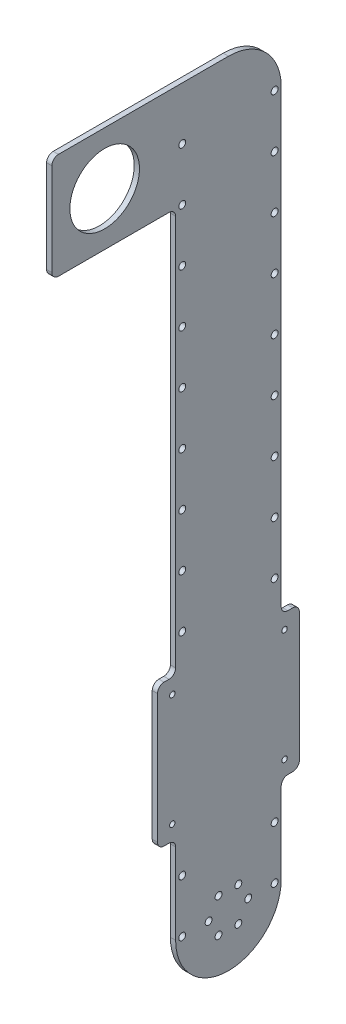
from build123d import *

# Parameters (mm, degrees)
BOSS_EXTRUDE1_DEPTH = 1.5875
SKETCH2_R           = 2.1
CUT_EXTRUDE1_DEPTH  = 243.144751389
SKETCH3_W           = 86
SKETCH3_H           = 86
SKETCH3_R           = 1.65
BOSS_EXTRUDE2_DEPTH = 3.175
FILLET1_R           = 4
SKETCH5_R           = 2.1
CUT_EXTRUDE3_DEPTH  = 244.842327386
SKETCH6_R           = 21.1
BOSS_EXTRUDE3_DEPTH = 3.175
FILLET2_R           = 4


with BuildPart() as part:
    # Sketch1 → Boss-Extrude1 (new, symmetric)
    with BuildSketch(Plane.YZ):
        with BuildLine():
            Line((-208, 32), (208, 32))
            ThreePointArc((208, 32), (240, 0), (208, -32))
            Line((208, -32), (-208, -32))
            ThreePointArc((-208, -32), (-240, 0), (-208, 32))
        make_face()
    extrude(amount=BOSS_EXTRUDE1_DEPTH, both=True)

    # Sketch2 → Cut-Extrude1 (cut, through all)
    with BuildSketch(Plane.YZ.offset(1.5875)):
        with Locations(Location((-208, 12, 0), (0, 0, 270))):
            Circle(SKETCH2_R)
        with Locations(Location((-197.607695155, 6, 0), (0, 0, 270))):
            Circle(SKETCH2_R)
        with Locations(Location((-197.607695155, -6, 0), (0, 0, 270))):
            Circle(SKETCH2_R)
        with Locations(Location((-208, -12, 0), (0, 0, 270))):
            Circle(SKETCH2_R)
        with Locations(Location((-218.392304845, -6, 0), (0, 0, 270))):
            Circle(SKETCH2_R)
        with Locations(Location((-218.392304845, 6, 0), (0, 0, 270))):
            Circle(SKETCH2_R)
    extrude(amount=-CUT_EXTRUDE1_DEPTH, mode=Mode.SUBTRACT)

    # Sketch3 → Boss-Extrude2 (add)
    with BuildSketch(Plane.YZ.offset(1.5875)):
        with Locations((-112, 0)):
            Rectangle(SKETCH3_W, SKETCH3_H)
        with Locations(Location((-146, 34, 0), (0, 0, 270))):
            Circle(SKETCH3_R, mode=Mode.SUBTRACT)
        with Locations(Location((-78, 34, 0), (0, 0, 270))):
            Circle(SKETCH3_R, mode=Mode.SUBTRACT)
        with Locations(Location((-78, -34, 0), (0, 0, 270))):
            Circle(SKETCH3_R, mode=Mode.SUBTRACT)
        with Locations(Location((-146, -34, 0), (0, 0, 270))):
            Circle(SKETCH3_R, mode=Mode.SUBTRACT)
    extrude(amount=-BOSS_EXTRUDE2_DEPTH)

    # Fillet1
    fillet1_edges = [part.edges().sort_by_distance(p)[0] for p in [
        (0, -69, 32),
        (0, -155, 32),
        (0, -155, -32),
        (0, -155, -43),
        (0, -69, 43),
        (0, -69, -32),
        (0, -155, 43),
        (0, -69, -43),
    ]]
    fillet(fillet1_edges, radius=FILLET1_R)

    # Sketch5 → Cut-Extrude3 (cut, through all)
    with BuildSketch(Plane.YZ.offset(1.5875)):
        with Locations(Location((-208, 28, 0), (0, 0, 270))):
            Circle(SKETCH5_R)
        with Locations(Location((-176, 28, 0), (0, 0, 270))):
            Circle(SKETCH5_R)
        with Locations(Location((-48, 28, 0), (0, 0, 270))):
            Circle(SKETCH5_R)
        with Locations(Location((-16, 28, 0), (0, 0, 270))):
            Circle(SKETCH5_R)
        with Locations(Location((16, 28, 0), (0, 0, 270))):
            Circle(SKETCH5_R)
        with Locations(Location((48, 28, 0), (0, 0, 270))):
            Circle(SKETCH5_R)
        with Locations(Location((80, 28, 0), (0, 0, 270))):
            Circle(SKETCH5_R)
        with Locations(Location((112, 28, 0), (0, 0, 270))):
            Circle(SKETCH5_R)
        with Locations(Location((144, 28, 0), (0, 0, 270))):
            Circle(SKETCH5_R)
        with Locations(Location((176, 28, 0), (0, 0, 270))):
            Circle(SKETCH5_R)
        with Locations(Location((176, -28, 0), (0, 0, 90))):
            Circle(SKETCH5_R)
        with Locations(Location((144, -28, 0), (0, 0, 90))):
            Circle(SKETCH5_R)
        with Locations(Location((112, -28, 0), (0, 0, 90))):
            Circle(SKETCH5_R)
        with Locations(Location((80, -28, 0), (0, 0, 90))):
            Circle(SKETCH5_R)
        with Locations(Location((48, -28, 0), (0, 0, 90))):
            Circle(SKETCH5_R)
        with Locations(Location((16, -28, 0), (0, 0, 90))):
            Circle(SKETCH5_R)
        with Locations(Location((-16, -28, 0), (0, 0, 90))):
            Circle(SKETCH5_R)
        with Locations(Location((-48, -28, 0), (0, 0, 90))):
            Circle(SKETCH5_R)
        with Locations(Location((-176, -28, 0), (0, 0, 90))):
            Circle(SKETCH5_R)
        with Locations(Location((-208, -28, 0), (0, 0, 90))):
            Circle(SKETCH5_R)
        with Locations(Location((208, 28, 0), (0, 0, 270))):
            Circle(SKETCH5_R)
        with Locations(Location((208, -28, 0), (0, 0, 90))):
            Circle(SKETCH5_R)
    extrude(amount=-CUT_EXTRUDE3_DEPTH, mode=Mode.SUBTRACT)

    # Sketch6 → Boss-Extrude3 (add)
    with BuildSketch(Plane.YZ.offset(1.5875)):
        with BuildLine():
            ThreePointArc((208, 32), (230.627416998, 22.627416998), (240, 0))
            Line((240, 0), (240, 107))
            Line((240, 107), (176, 107))
            Line((176, 107), (176, 32))
            Line((176, 32), (208, 32))
        make_face()
        with Locations(Location((208, 75, 0), (0, 0, 270))):
            Circle(SKETCH6_R, mode=Mode.SUBTRACT)
    extrude(amount=-BOSS_EXTRUDE3_DEPTH)

    # Fillet2
    fillet2_edges = [part.edges().sort_by_distance(p)[0] for p in [
        (0, 240, 107),
        (0, 176, 107),
        (0, 176, 32),
    ]]
    fillet(fillet2_edges, radius=FILLET2_R)


solid = part.part
